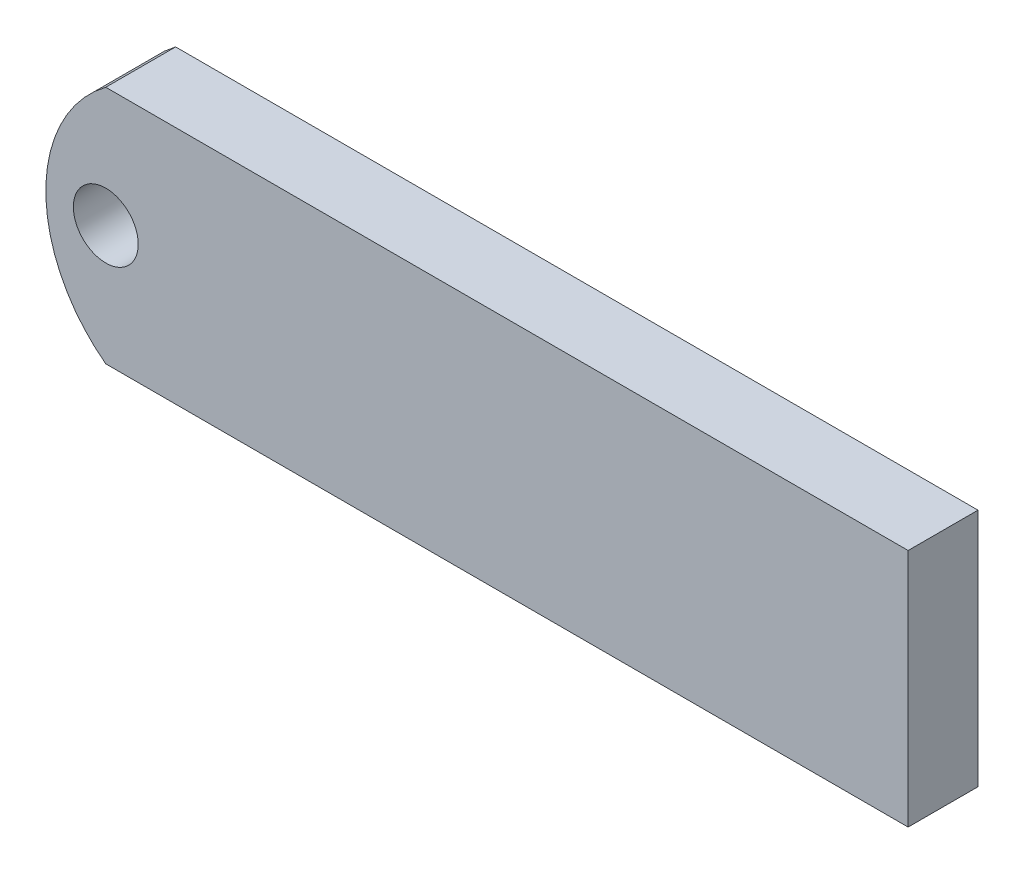
from build123d import *

# Parameters (mm, degrees)
CROQUIS1_R              = 3.25
SALIENTE_EXTRUIR1_DEPTH = 7


with BuildPart() as part:
    # Croquis1 → Saliente-Extruir1 (new body)
    with BuildSketch(Plane.XY):
        with BuildLine():
            Line((0, 12), (80.387242704, 12))
            Line((80.387242704, 12), (80.387242704, -12))
            Line((80.387242704, -12), (0, -12))
            ThreePointArc((0, -12), (-6.00604208, 0), (0, 12))
        make_face()
        Circle(CROQUIS1_R, mode=Mode.SUBTRACT)
    extrude(amount=SALIENTE_EXTRUIR1_DEPTH)


solid = part.part
